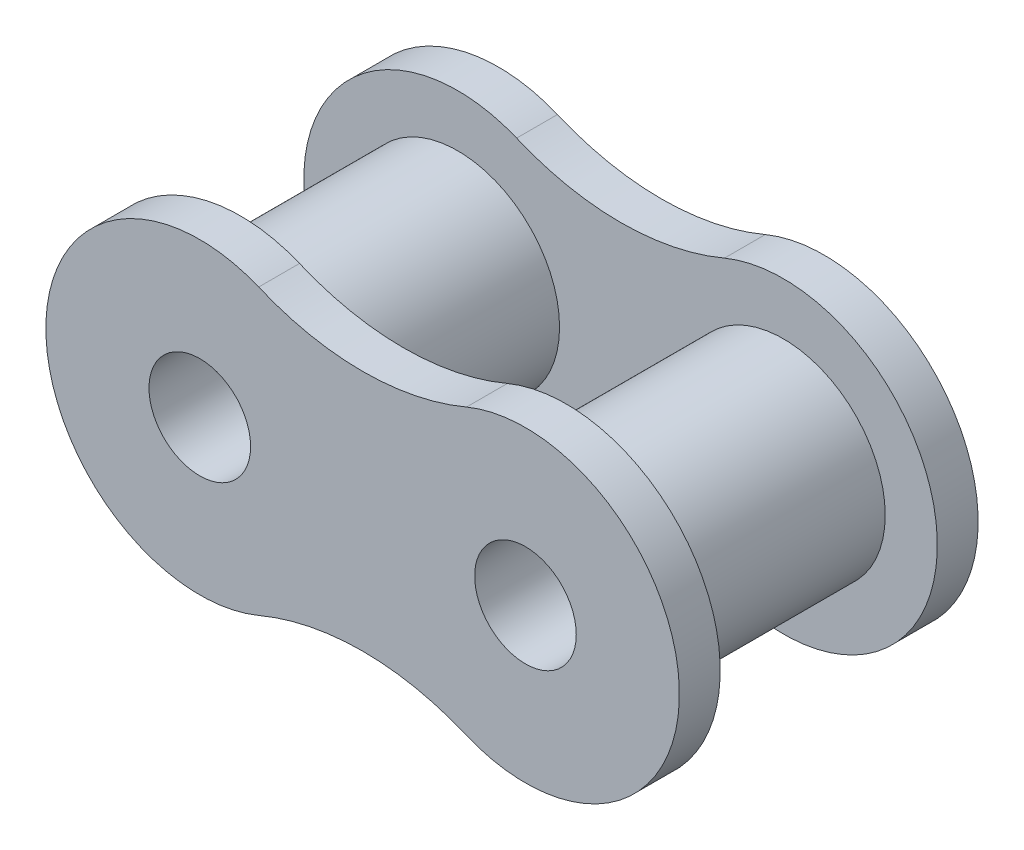
from build123d import *

# Parameters (mm, degrees)
SKETCH1_R           = 2.9718
BOSS_EXTRUDE1_DEPTH = 2.3876
SKETCH2_R           = 5.9563
SKETCH2_R_2         = 2.9718
BOSS_EXTRUDE2_DEPTH = 12.7
SKETCH3_R           = 2.9718
BOSS_EXTRUDE3_DEPTH = 2.3876


with BuildPart() as part:
    # Sketch1 → Boss-Extrude1 (new body)
    # profile 1 of 7: a face of its own
    with BuildSketch(Plane.XY):
        with BuildLine():
            Line((-5.02285, 4.50215), (-9.525, 9.0043))
            ThreePointArc((-9.525, 9.0043), (-18.3562849, -1.756651787), (-6.07920357, -8.318888475))
            ThreePointArc((-6.07920357, -8.318888475), (-6.038523344, -8.30173624), (-5.997794724, -8.284699236))
            ThreePointArc((-5.997794724, -8.284699236), (-2.013760656, -4.965752915), (-0.5207, 0))
            Line((-0.5207, 0), (-5.02285, 4.50215))
        make_face()
        with Locations((-9.525, 0)):
            Circle(SKETCH1_R, mode=Mode.SUBTRACT)
    # profile 2 of 7: a face of its own
    with BuildSketch(Plane.XY):
        with BuildLine():
            ThreePointArc((-6.07920357, 8.318888475), (-7.768348213, 8.8312849), (-9.525, 9.0043))
            Line((-9.525, 9.0043), (-5.02285, 4.50215))
            Line((-5.02285, 4.50215), (-3.15799841, 6.36700159))
            ThreePointArc((-3.15799841, 6.36700159), (-4.485831076, 7.462184335), (-5.997794724, 8.284699236))
            ThreePointArc((-5.997794724, 8.284699236), (-6.038523344, 8.30173624), (-6.07920357, 8.318888475))
        make_face()
    # profile 3 of 7: a face of its own
    with BuildSketch(Plane.XY):
        with BuildLine():
            ThreePointArc((-3.15799841, 6.36700159), (-1.206111525, 3.44579643), (-0.5207, 0))
            ThreePointArc((-0.5207, 0), (-2.013760656, -4.965752915), (-5.997794724, -8.284699236))
            ThreePointArc((-5.997794724, -8.284699236), (0, -7.08520242), (5.997794724, -8.284699236))
            ThreePointArc((5.997794724, -8.284699236), (0.685208337, -1.713330628), (3.15799841, 6.36700159))
            Line((3.15799841, 6.36700159), (0, 6.36700159))
            Line((0, 6.36700159), (-3.15799841, 6.36700159))
        make_face()
    # profile 4 of 7: a face of its own
    with BuildSketch(Plane.XY):
        with BuildLine():
            Line((-3.15799841, 6.36700159), (-5.02285, 4.50215))
            Line((-5.02285, 4.50215), (-0.5207, 0))
            ThreePointArc((-0.5207, 0), (-1.206111525, 3.44579643), (-3.15799841, 6.36700159))
        make_face()
    # profile 5 of 7: a face of its own
    with BuildSketch(Plane.XY):
        with BuildLine():
            ThreePointArc((-5.997794724, 8.284699236), (-4.485831076, 7.462184335), (-3.15799841, 6.36700159))
            Line((-3.15799841, 6.36700159), (0, 6.36700159))
            Line((0, 6.36700159), (0, 7.08520242))
            ThreePointArc((0, 7.08520242), (-3.058281141, 7.388016551), (-5.997794724, 8.284699236))
        make_face()
    # profile 6 of 7: a face of its own
    with BuildSketch(Plane.XY):
        with BuildLine():
            ThreePointArc((5.997794724, 8.284699236), (3.058281141, 7.388016551), (0, 7.08520242))
            Line((0, 7.08520242), (0, 6.36700159))
            Line((0, 6.36700159), (3.15799841, 6.36700159))
            ThreePointArc((3.15799841, 6.36700159), (4.485831076, 7.462184335), (5.997794724, 8.284699236))
        make_face()
    # profile 7 of 7: a face of its own
    with BuildSketch(Plane.XY):
        with BuildLine():
            ThreePointArc((18.5293, 0), (15.89200159, 6.36700159), (9.525, 9.0043))
            ThreePointArc((9.525, 9.0043), (7.768348213, 8.8312849), (6.07920357, 8.318888475))
            ThreePointArc((6.07920357, 8.318888475), (6.038523344, 8.30173624), (5.997794724, 8.284699236))
            ThreePointArc((5.997794724, 8.284699236), (4.485831076, 7.462184335), (3.15799841, 6.36700159))
            ThreePointArc((3.15799841, 6.36700159), (0.685208337, -1.713330628), (5.997794724, -8.284699236))
            ThreePointArc((5.997794724, -8.284699236), (6.038523344, -8.30173624), (6.07920357, -8.318888475))
            ThreePointArc((6.07920357, -8.318888475), (14.527521049, -7.48680183), (18.5293, 0))
        make_face()
        with Locations((9.525, 0)):
            Circle(SKETCH1_R, mode=Mode.SUBTRACT)
    extrude(amount=BOSS_EXTRUDE1_DEPTH)

    # Sketch2 → Boss-Extrude2 (add)
    # profile 1 of 2: a face of its own
    with BuildSketch(Plane.XY.offset(2.3876)):
        with Locations((9.525, 0)):
            Circle(SKETCH2_R)
        with Locations((9.525, 0)):
            Circle(SKETCH2_R_2, mode=Mode.SUBTRACT)
    # profile 2 of 2: a face of its own
    with BuildSketch(Plane.XY.offset(2.3876)):
        with Locations((-9.525, 0)):
            Circle(SKETCH2_R)
        with Locations((-9.525, 0)):
            Circle(SKETCH2_R_2, mode=Mode.SUBTRACT)
    extrude(amount=BOSS_EXTRUDE2_DEPTH)

    # Sketch3 → Boss-Extrude3 (add)
    with BuildSketch(Plane.XY.offset(15.0876)):
        with BuildLine():
            ThreePointArc((6.07920357, -8.318888475), (18.5293, 0), (6.07920357, 8.318888475))
            ThreePointArc((6.07920357, 8.318888475), (0, 7.08520242), (-6.07920357, 8.318888475))
            ThreePointArc((-6.07920357, 8.318888475), (-18.5293, 0), (-6.07920357, -8.318888475))
            ThreePointArc((-6.07920357, -8.318888475), (0, -7.08520242), (6.07920357, -8.318888475))
        make_face()
        with Locations((-9.525, 0)):
            Circle(SKETCH3_R, mode=Mode.SUBTRACT)
        with Locations((9.525, 0)):
            Circle(SKETCH3_R, mode=Mode.SUBTRACT)
    extrude(amount=BOSS_EXTRUDE3_DEPTH)


solid = part.part
